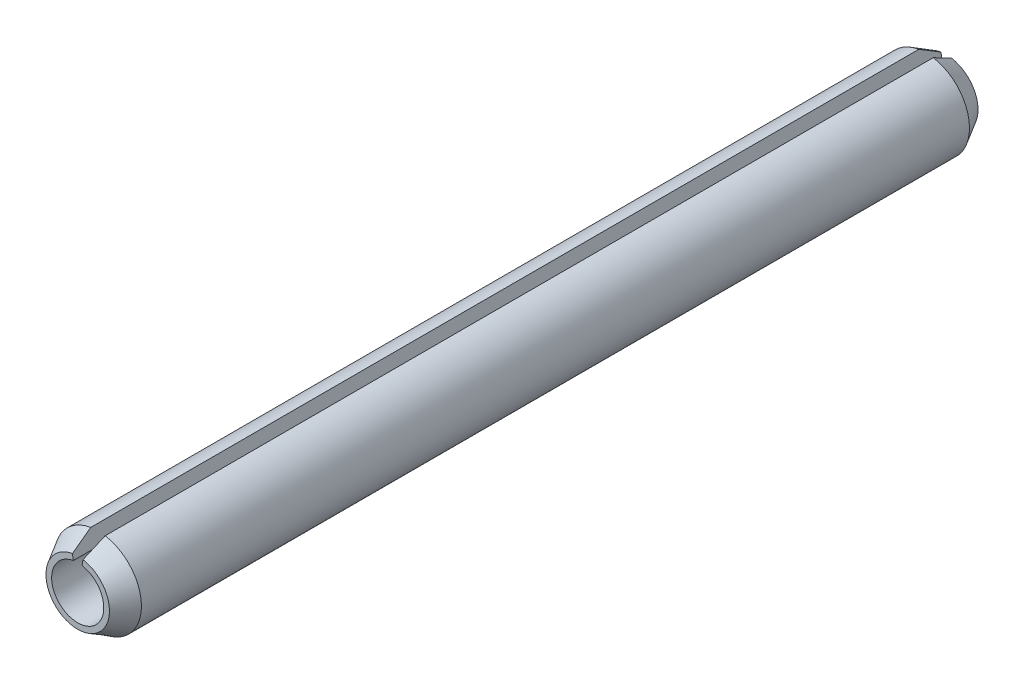
from build123d import *

# Parameters (mm, degrees)
BASE_EXTRUDE_THIN_DEPTH = 30
CHAMFER1_SIZE           = 1.4
CHAMFER1_SIZE2          = 0.808290377


with BuildPart() as part:
    # Sketch1 → Base-Extrude-Thin (new, symmetric)
    with BuildSketch(Plane.XY):
        with BuildLine():
            ThreePointArc((-0.5, 2.958039892), (0, -3), (0.5, 2.958039892))
            Line((0.5, 2.958039892), (0.3, 1.774823935))
            ThreePointArc((0.3, 1.774823935), (0, -1.8), (-0.3, 1.774823935))
            Line((-0.3, 1.774823935), (-0.5, 2.958039892))
        make_face()
    extrude(amount=BASE_EXTRUDE_THIN_DEPTH, both=True)

    # Chamfer1
    chamfer1_edges = [part.edges().sort_by_distance(p)[0] for p in [
        (0, -3, 30),
        (0, -3, -30),
    ]]
    chamfer1_side = [part.faces().sort_by_distance(p)[0] for p in [
        (0, -3, 0),
    ]]
    chamfer(chamfer1_edges, length=CHAMFER1_SIZE, length2=CHAMFER1_SIZE2, reference=chamfer1_side[0])


solid = part.part
